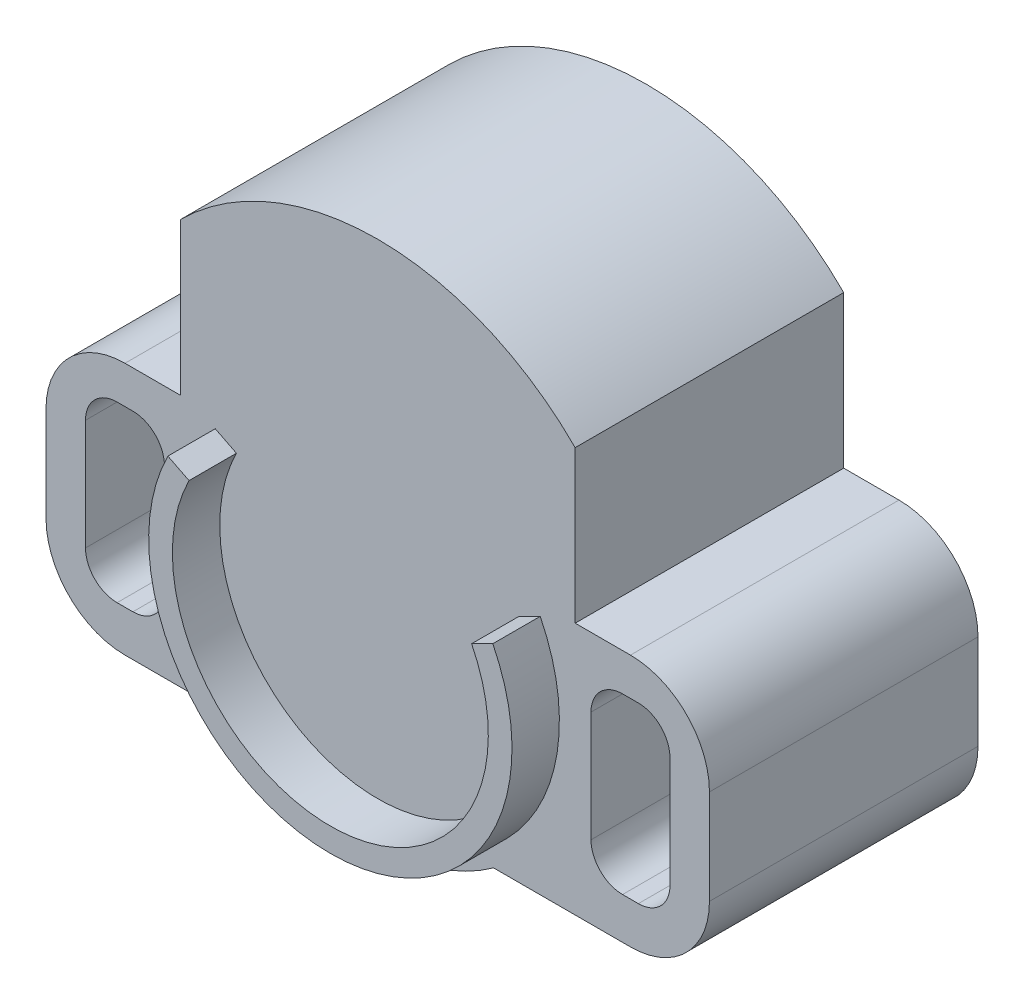
from build123d import *

# Parameters (mm, degrees)
BASE_EXTRUSION_DEPTH    = 17
ENL_V_MAT_EXTRU_1_DEPTH = 17
ESQUISSE3_R             = 11.5
BOSS_EXTRU_1_DEPTH      = 3
ESQUISSE4_R             = 10
ENL_V_MAT_EXTRU_2_DEPTH = 3
ENL_V_MAT_EXTRU_3_DEPTH = 3


with BuildPart() as part:
    # Esquisse1 → Base-Extrusion (new body)
    with BuildSketch(Plane.XY):
        with BuildLine():
            Line((-16, -10.124371965), (-7.331240844, -10.124371965))
            ThreePointArc((-7.331240844, -10.124371965), (0, -12.5), (7.331240844, -10.124371965))
            Line((7.331240844, -10.124371965), (16, -10.124371965))
            ThreePointArc((16, -10.124371965), (19.535533906, -8.659905871), (21, -5.124371965))
            Line((21, -5.124371965), (21, 0.875628035))
            ThreePointArc((21, 0.875628035), (19.535533906, 4.411161941), (16, 5.875628035))
            Line((16, 5.875628035), (12.5, 5.875628035))
            Line((12.5, 5.875628035), (12.5, 15.5))
            ThreePointArc((12.5, 15.5), (0, 20.67766953), (-12.5, 15.5))
            Line((-12.5, 15.5), (-12.5, 5.875628035))
            Line((-12.5, 5.875628035), (-16, 5.875628035))
            ThreePointArc((-16, 5.875628035), (-19.535533906, 4.411161941), (-21, 0.875628035))
            Line((-21, 0.875628035), (-21, -5.124371965))
            ThreePointArc((-21, -5.124371965), (-19.535533906, -8.659905871), (-16, -10.124371965))
        make_face()
    extrude(amount=BASE_EXTRUSION_DEPTH)

    # Esquisse2 → Enlèv. mat.-Extru.1 (cut)
    with BuildSketch(Plane.XY.offset(17)):
        with BuildLine():
            Line((-16.5, 3.5), (-15.5, 3.5))
            ThreePointArc((-15.5, 3.5), (-14.085786438, 2.914213562), (-13.5, 1.5))
            Line((-13.5, 1.5), (-13.5, -5.5))
            ThreePointArc((-13.5, -5.5), (-14.085786438, -6.914213562), (-15.5, -7.5))
            Line((-15.5, -7.5), (-16.5, -7.5))
            ThreePointArc((-16.5, -7.5), (-17.914213562, -6.914213562), (-18.5, -5.5))
            Line((-18.5, -5.5), (-18.5, 1.5))
            ThreePointArc((-18.5, 1.5), (-17.914213562, 2.914213562), (-16.5, 3.5))
        make_face()
        with BuildLine():
            Line((15.5, 3.5), (16.5, 3.5))
            ThreePointArc((16.5, 3.5), (17.914213562, 2.914213562), (18.5, 1.5))
            Line((18.5, 1.5), (18.5, -5.5))
            ThreePointArc((18.5, -5.5), (17.914213562, -6.914213562), (16.5, -7.5))
            Line((16.5, -7.5), (15.5, -7.5))
            ThreePointArc((15.5, -7.5), (14.085786438, -6.914213562), (13.5, -5.5))
            Line((13.5, -5.5), (13.5, 1.5))
            ThreePointArc((13.5, 1.5), (14.085786438, 2.914213562), (15.5, 3.5))
        make_face()
    extrude(amount=-ENL_V_MAT_EXTRU_1_DEPTH, mode=Mode.SUBTRACT)

    # Esquisse3 → Boss.-Extru.1 (add)
    with BuildSketch(Plane.XY.offset(17)):
        Circle(ESQUISSE3_R)
    extrude(amount=BOSS_EXTRU_1_DEPTH)

    # Esquisse4 → Enlèv. mat.-Extru.2 (cut)
    with BuildSketch(Plane.XY.offset(20)):
        Circle(ESQUISSE4_R)
    extrude(amount=-ENL_V_MAT_EXTRU_2_DEPTH, mode=Mode.SUBTRACT)

    # Esquisse5 → Enlèv. mat.-Extru.3 (cut)
    with BuildSketch(Plane.XY.offset(20)):
        with BuildLine():
            Line((-20, 10), (0, 0))
            Line((0, 0), (20, 10))
            ThreePointArc((20, 10), (0, 22.360679775), (-20, 10))
        make_face()
    extrude(amount=-ENL_V_MAT_EXTRU_3_DEPTH, mode=Mode.SUBTRACT)


solid = part.part
